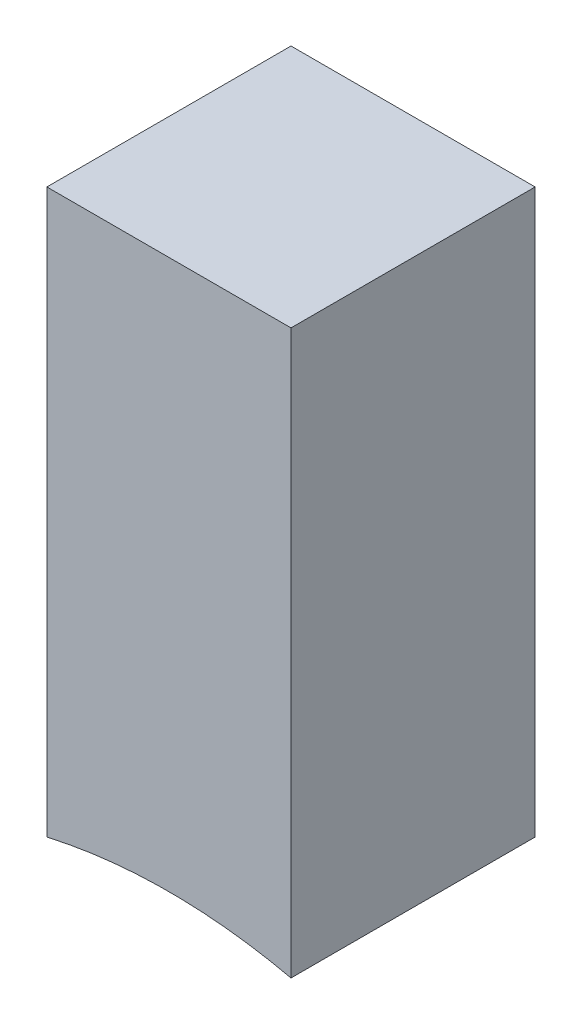
from build123d import *

# Parameters (mm, degrees)
SKIZZE1_W                       = 4
SKIZZE1_H                       = 10
AUFSATZ_LINEAR_AUSTRAGEN1_DEPTH = 4
SKIZZE2_R                       = 9
SCHNITT_LINEAR_AUSTRAGEN1_DEPTH = 4


with BuildPart() as part:
    # Skizze1 → Aufsatz-Linear austragen1 (new body)
    with BuildSketch(Plane.XY):
        Rectangle(SKIZZE1_W, SKIZZE1_H)
    extrude(amount=AUFSATZ_LINEAR_AUSTRAGEN1_DEPTH)

    # Skizze2 → Schnitt-Linear austragen1 (cut)
    with BuildSketch(Plane.XY.offset(4)):
        with Locations((0, -13)):
            Circle(SKIZZE2_R)
    extrude(amount=-SCHNITT_LINEAR_AUSTRAGEN1_DEPTH, mode=Mode.SUBTRACT)


solid = part.part
